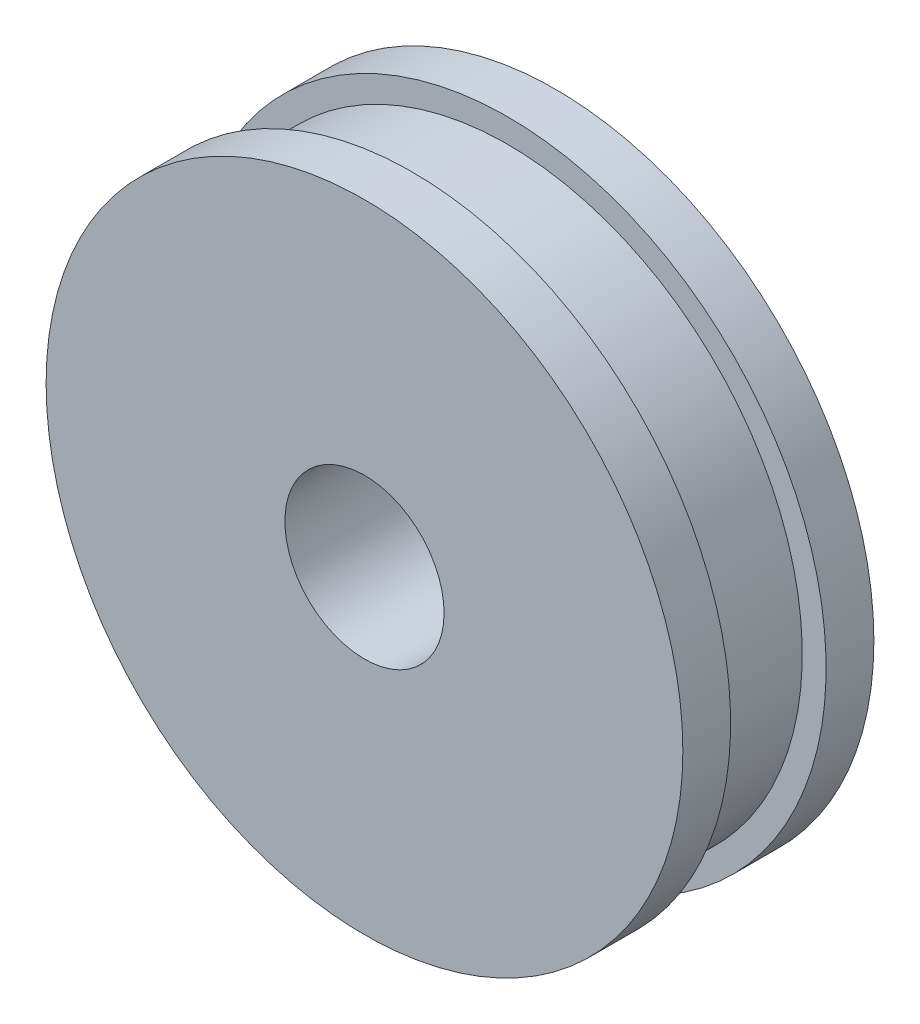
from build123d import *

# Parameters (mm, degrees)
SKETCH1_R           = 20
SKETCH1_R_2         = 5
BOSS_EXTRUDE1_DEPTH = 12
SKETCH2_W           = 1.5
SKETCH2_H           = 6


with BuildPart() as part:
    # Sketch1 → Boss-Extrude1 (new body)
    with BuildSketch(Plane.XY):
        Circle(SKETCH1_R)
        Circle(SKETCH1_R_2, mode=Mode.SUBTRACT)
    extrude(amount=BOSS_EXTRUDE1_DEPTH)

    # Sketch2 → Cut-Revolve1 (revolve, cut)
    with BuildSketch(Plane(origin=(0, 0, 0), x_dir=(1, 0, 0), z_dir=(0, 1, 0))):
        with Locations((-19.25, -6)):
            Rectangle(SKETCH2_W, SKETCH2_H)
    revolve(axis=Axis((0, 0, -8.60208194), (0, 0, 1)), mode=Mode.SUBTRACT)


solid = part.part
